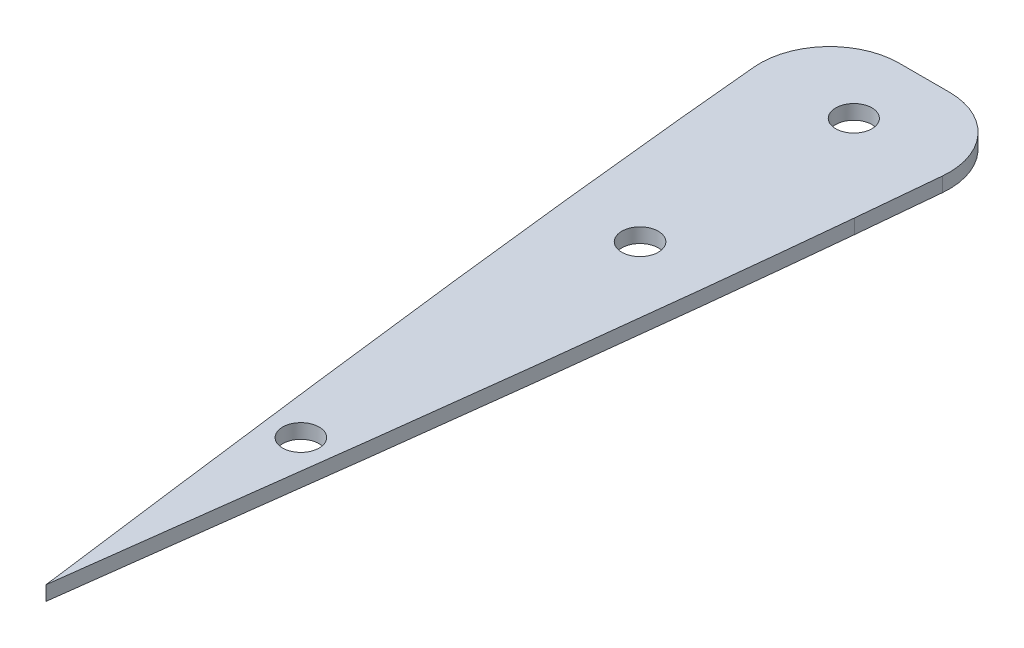
from build123d import *

# Parameters (mm, degrees)
SKETCH1_R               = 1.984375
BOSS_EXTRUDE1_DEPTH     = 169.87265999999997
CUT_EXTRUDE1_DEPTH      = 23.05812
CUT_EXTRUDE2_START      = -169.87266
CUT_EXTRUDE2_DEPTH      = 23.05812
FILLET1_R               = 7.62
CUT_EXTRUDE3_DEPTH      = 198.3909425992125
CUT_EXTRUDE3_DEPTH_BACK = 198.3909425992125
SKETCH6_R               = 2.000000000000001
SKETCH6_R_2             = 2.0000000000000004
CUT_EXTRUDE4_DEPTH      = 198.3909425992125
CUT_EXTRUDE4_DEPTH_BACK = 198.3909425992125
SKETCH7_W               = 96.26632678346117
SKETCH7_H               = 127.9185977098139
SKETCH7_H_2             = 40.36656229018607


with BuildPart() as part:
    # Sketch1 → Boss-Extrude1 (new body)
    with BuildSketch(Plane(origin=(0, 0, 0), x_dir=(1, 0, 0), z_dir=(0, 1, 0))):
        with BuildLine():
            Line((-9.955287346489113, -3.6074515728352274), (-6.769721367669625, -3.607451572835229))
            Line((-6.769721367669625, -3.607451572835229), (8.985913588520251, -3.607451572835254))
            Line((8.985913588520251, -3.607451572835254), (12.171479567676489, -3.6074515728352536))
            add(Edge.make_bspline(
                [(10.60289964969583, -20.752451572835255), (11.099968974105764, -15.73020157118813), (11.63056361676114, -10.016003165571298), (12.113997871046978, -4.296816952278091), (12.171479567676489, -3.6074515728352536)],
                knots=[0.38496962590391054, 0.38496962590391054, 0.38496962590391054, 0.38496962590391054, 0.4581086713676085, 0.468131593311824, 0.468131593311824, 0.468131593311824, 0.468131593311824], degree=3))
            add(Edge.make_bspline(
                [(1.1080961105936413, -99.87377835629641), (4.527344743513003, -73.53176416291807), (7.98655990047842, -47.18721965154313), (10.60289964969583, -20.752451572835255)],
                knots=[0, 0, 0, 0, 0.38496962590391054, 0.38496962590391054, 0.38496962590391054, 0.38496962590391054], degree=3))
            add(Edge.make_bspline(
                [(1.1080961105936413, -99.87377835629641), (-2.311152522316452, -73.53176416292023), (-5.77036767929202, -47.18721965154205), (-8.386707428509173, -20.752451572835213)],
                knots=[0, 0, 0, 0, 0.3849696259039116, 0.3849696259039116, 0.3849696259039116, 0.3849696259039116], degree=3))
            add(Edge.make_bspline(
                [(-8.386707428509173, -20.752451572835213), (-8.88377675291906, -15.730201571188243), (-9.414371395575616, -10.016003165551764), (-9.897805649859515, -4.296816952279357), (-9.955287346489113, -3.6074515728352274)],
                knots=[0.3849696259039116, 0.3849696259039116, 0.3849696259039116, 0.3849696259039116, 0.4581086713676079, 0.46813159331185, 0.46813159331185, 0.46813159331185, 0.46813159331185], degree=3))
        make_face()
        with Locations(Location((1.10810856874065, -11.326456678177, 0), (0, 0, 270))):
            Circle(SKETCH1_R, mode=Mode.SUBTRACT)
    extrude(amount=BOSS_EXTRUDE1_DEPTH)

    # Sketch2 → Cut-Extrude1 (cut)
    with BuildSketch(Plane(origin=(0, 169.87265999999997, 0), x_dir=(1, 0, 0), z_dir=(0, 1, 0))):
        Polygon((-9.955287346489113, -3.6074515728352274), (25.808519749497883, -3.6074515728352274), (25.808519749497883, -26.312456678177), (-9.95528734648911, -26.312456678177), align=None)
    extrude(amount=-CUT_EXTRUDE1_DEPTH, mode=Mode.SUBTRACT)

    # Sketch2<2> → Cut-Extrude2 (cut)
    with BuildSketch(Plane(origin=(0, 169.87265999999997, 0), x_dir=(1, 0, 0), z_dir=(0, 1, 0)).offset(CUT_EXTRUDE2_START)):
        Polygon((-9.955287346489113, -3.6074515728352274), (25.808519749497883, -3.6074515728352274), (25.808519749497883, -26.312456678177), (-9.95528734648911, -26.312456678177), align=None)
    extrude(amount=CUT_EXTRUDE2_DEPTH, mode=Mode.SUBTRACT)

    # Fillet1
    fillet1_edges = [part.edges().sort_by_distance(p)[0] for p in [
        (-7.8241553741226255, 11.529059999999971, 26.312456678177),
        (10.040347595309392, 11.529059999999971, 26.312456678177),
        (-9.955287346489113, 84.93632999999997, 3.6074515728352274),
        (12.171479567676489, 84.93632999999997, 3.6074515728352536),
        (-7.8241553741226255, 158.34359999999998, 26.312456678177),
        (10.040347595309392, 158.34359999999998, 26.312456678177),
    ]]
    fillet(fillet1_edges, radius=FILLET1_R)

    # Sketch6 → Cut-Extrude3 (cut, two sides: drawn at the far end of the back side and taken through both)
    with BuildSketch(Plane.XZ.offset(-CUT_EXTRUDE3_DEPTH_BACK)):
        with Locations(Location((1.1080961105936413, 71.9337783562964, 0), (0, 0, 270))):
            Circle(SKETCH6_R)
        with Locations(Location((1.1080961105935272, 34.76055213743882, 0), (0, 0, 270))):
            Circle(SKETCH6_R_2)
    extrude(amount=CUT_EXTRUDE3_DEPTH + CUT_EXTRUDE3_DEPTH_BACK, mode=Mode.SUBTRACT)

    # Sketch7 → Cut-Extrude4 (cut, two sides: drawn at the far end of the back side and taken through both)
    with BuildSketch(Plane(origin=(0, 0, 0), x_dir=(0, 0, -1), z_dir=(1, 0, 0)).offset(-CUT_EXTRUDE4_DEPTH_BACK)):
        with Locations((-51.740614964565815, 63.95929885490695)):
            Rectangle(SKETCH7_W, SKETCH7_H)
        with Locations((-51.740614964565815, 149.68937885490692)):
            Rectangle(SKETCH7_W, SKETCH7_H_2)
    extrude(amount=CUT_EXTRUDE4_DEPTH + CUT_EXTRUDE4_DEPTH_BACK, mode=Mode.SUBTRACT)


solid = part.part
